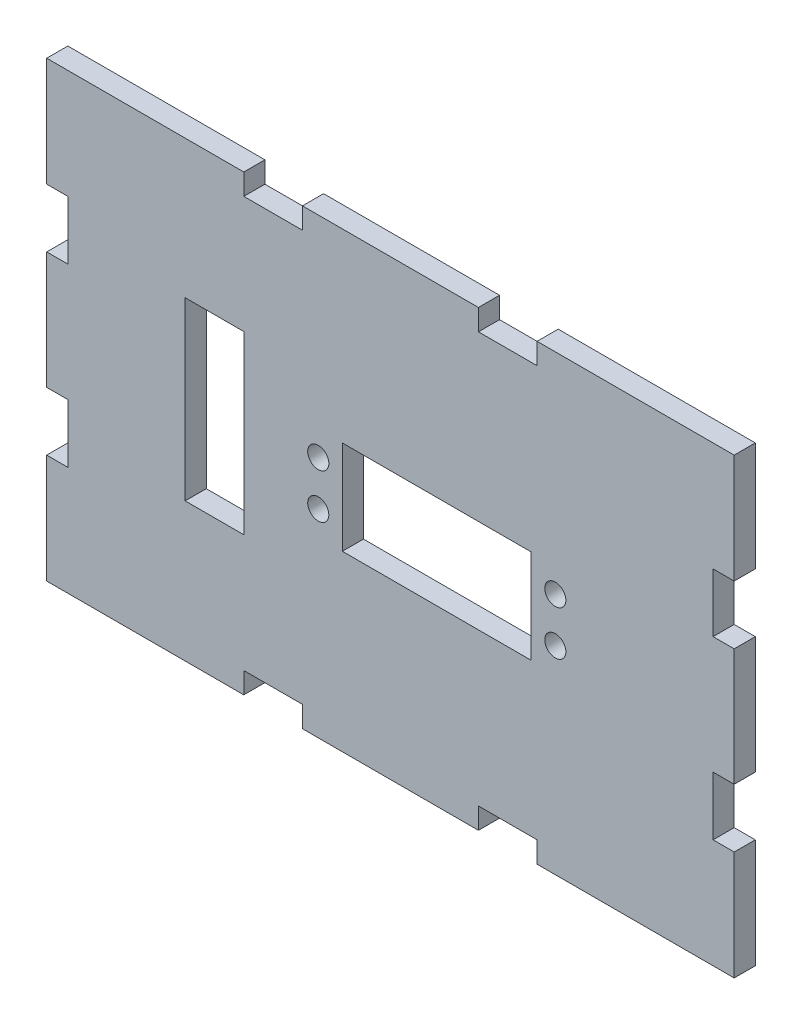
from build123d import *

# Parameters (mm, degrees)
SKETCH2_W           = 148.844
SKETCH2_H           = 98.044
BOSS_EXTRUDE1_DEPTH = 4.572
SKETCH3_W           = 12.7
SKETCH3_H           = 4.572
SKETCH3_W_2         = 4.572
SKETCH3_H_2         = 12.7
CUT_EXTRUDE1_DEPTH  = 4.572
SKETCH4_R           = 2.286
SKETCH4_W           = 40.894
SKETCH4_H           = 20.32
CUT_EXTRUDE2_DEPTH  = 179.292079061
SKETCH5_W           = 12.7
SKETCH5_H           = 38.1
CUT_EXTRUDE3_DEPTH  = 4.572


with BuildPart() as part:
    # Sketch2 → Boss-Extrude1 (new body)
    with BuildSketch(Plane.XY):
        with Locations((74.422, 49.022)):
            Rectangle(SKETCH2_W, SKETCH2_H)
    extrude(amount=BOSS_EXTRUDE1_DEPTH)

    # Sketch3 → Cut-Extrude1 (cut)
    with BuildSketch(Plane.XY.offset(4.572)):
        with Locations((49.022, 2.286)):
            Rectangle(SKETCH3_W, SKETCH3_H)
        with Locations((99.822, 2.286)):
            Rectangle(SKETCH3_W, SKETCH3_H)
        with Locations((2.286, 29.972)):
            Rectangle(SKETCH3_W_2, SKETCH3_H_2)
        with Locations((2.286, 68.072)):
            Rectangle(SKETCH3_W_2, SKETCH3_H_2)
        with Locations((49.022, 95.758)):
            Rectangle(SKETCH3_W, SKETCH3_H)
        with Locations((99.822, 95.758)):
            Rectangle(SKETCH3_W, SKETCH3_H)
        with Locations((146.558, 68.072)):
            Rectangle(SKETCH3_W_2, SKETCH3_H_2)
        with Locations((146.558, 29.972)):
            Rectangle(SKETCH3_W_2, SKETCH3_H_2)
    extrude(amount=-CUT_EXTRUDE1_DEPTH, mode=Mode.SUBTRACT)

    # Sketch4 → Cut-Extrude2 (cut, through all)
    with BuildSketch(Plane.XY.offset(4.572)):
        with Locations((58.794000014, 52.578)):
            Circle(SKETCH4_R)
        with Locations(Location((110.115999986, 52.578, 0), (0, 0, 180))):
            Circle(SKETCH4_R)
        with Locations((110.115999986, 42.926)):
            Circle(SKETCH4_R)
        with Locations(Location((58.794000014, 42.926, 0), (0, 0, 180))):
            Circle(SKETCH4_R)
        with Locations((84.455, 47.752)):
            Rectangle(SKETCH4_W, SKETCH4_H)
    extrude(amount=-CUT_EXTRUDE2_DEPTH, mode=Mode.SUBTRACT)

    # Sketch5 → Cut-Extrude3 (cut)
    with BuildSketch(Plane.XY.offset(4.572)):
        with Locations((36.322, 49.0765215)):
            Rectangle(SKETCH5_W, SKETCH5_H)
    extrude(amount=-CUT_EXTRUDE3_DEPTH, mode=Mode.SUBTRACT)


solid = part.part
